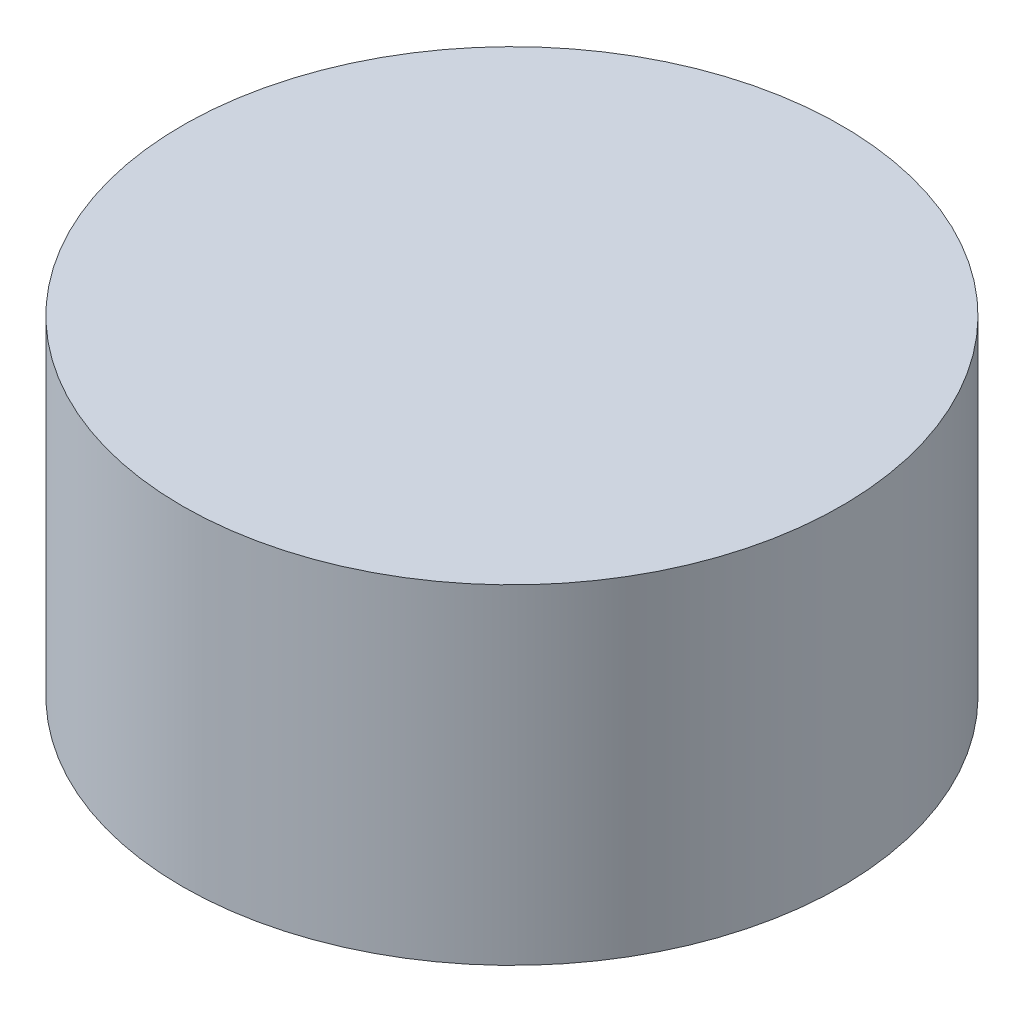
from build123d import *

# Parameters (mm, degrees)
ESQUISSE1_R        = 46
BOSS_EXTRU_1_DEPTH = 46


with BuildPart() as part:
    # Esquisse1 → Boss.-Extru.1 (new body)
    with BuildSketch(Plane(origin=(0, 0, 0), x_dir=(1, 0, 0), z_dir=(0, 1, 0))):
        with Locations(Location((0, 0, 0), (0, 0, 270))):
            Circle(ESQUISSE1_R)
    extrude(amount=BOSS_EXTRU_1_DEPTH)


solid = part.part
